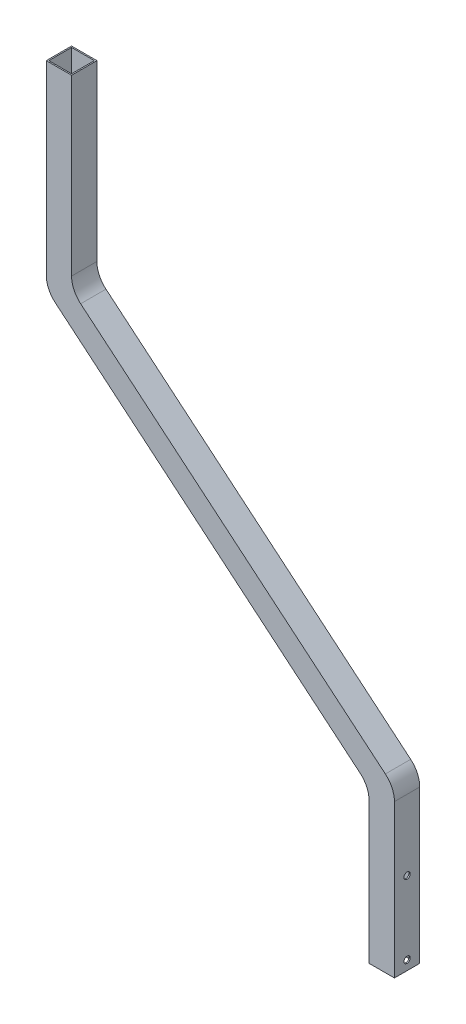
from build123d import *

# Parameters (mm, degrees)
BOSS_EXTRUDE1_DEPTH           = 50.8
FILLET1_R                     = 50.8
SHELL1_T                      = -2.54
SKETCH2_W                     = 45.72
SKETCH2_H                     = 45.72
CUT_EXTRUDE1_DEPTH            = 50.8
F_97_0_5_DIAMETER_HOLE1_D     = 12.7
F_97_0_5_DIAMETER_HOLE2_D     = 12.7
F_97_0_5_DIAMETER_HOLE2_DEPTH = 12.7
F_97_0_5_DIAMETER_HOLE2_TIP   = 3.815464931


with BuildPart() as part:
    # Sketch1 → Boss-Extrude1 (new body)
    with BuildSketch(Plane.XY):
        Polygon((0, 0), (0, 330.2), (-647.7, 871.912727273), (-647.7, 1244.6), (-698.5, 1244.6), (-698.5, 848.174564223), (-50.8, 306.461836951), (-50.8, 0), align=None)
    extrude(amount=BOSS_EXTRUDE1_DEPTH)

    # Fillet1
    fillet1_edges = [part.edges().sort_by_distance(p)[0] for p in [
        (-50.8, 306.461836951, 25.4),
        (-698.5, 848.174564223, 25.4),
        (-647.7, 871.912727273, 25.4),
        (0, 330.2, 25.4),
    ]]
    fillet(fillet1_edges, radius=FILLET1_R)

    # Shell1
    shell1_openings = [part.faces().sort_by_distance(p)[0] for p in [
        (-673.1, 1244.6, 25.4),
    ]]
    offset(amount=SHELL1_T, openings=shell1_openings, kind=Kind.INTERSECTION)

    # Sketch2 → Cut-Extrude1 (cut)
    with BuildSketch(Plane.XZ):
        with Locations((-25.4, 25.4)):
            Rectangle(SKETCH2_W, SKETCH2_H)
    extrude(amount=-CUT_EXTRUDE1_DEPTH, mode=Mode.SUBTRACT)

    # #97 (0.5) Diameter Hole1 (through all)
    with Locations(Plane(origin=(0, 19.05, 25.4), x_dir=(0, 0, 1), z_dir=(1, 0, 0))):
        with Locations((0, 0), (0, -146.05)):
            Hole(F_97_0_5_DIAMETER_HOLE1_D / 2)

    # #97 (0.5) Diameter Hole2
    with Locations(Plane(origin=(-582.872241676, 751.467711807, 25.4), x_dir=(-0.767076870152, 0.641555200491, 0), z_dir=(-0.641555200491, -0.767076870152, 0))):
        with Locations((-1e-09, 0)):
            Hole(F_97_0_5_DIAMETER_HOLE2_D / 2, depth=F_97_0_5_DIAMETER_HOLE2_DEPTH)
            with Locations((0, 0, -(F_97_0_5_DIAMETER_HOLE2_DEPTH + F_97_0_5_DIAMETER_HOLE2_TIP / 2))):  # 118° drill point
                Cone(0, F_97_0_5_DIAMETER_HOLE2_D / 2, F_97_0_5_DIAMETER_HOLE2_TIP, mode=Mode.SUBTRACT)


solid = part.part
